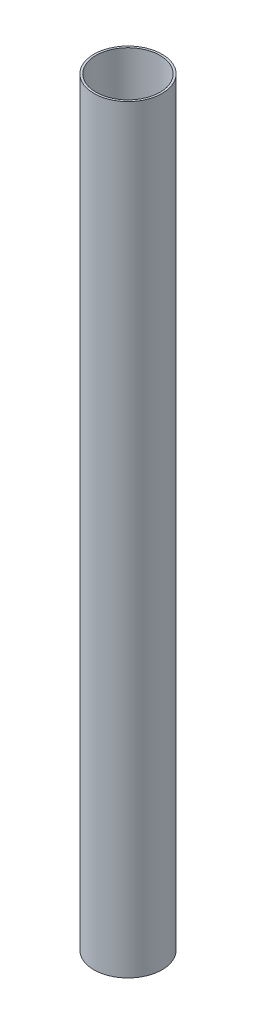
from build123d import *

# Parameters (mm, degrees)
SKETCH1_R           = 22.225
SKETCH1_R_2         = 20.8788
EXTRUDE_THIN1_DEPTH = 495.3


with BuildPart() as part:
    # Sketch1 → Extrude-Thin1 (new body)
    with BuildSketch(Plane(origin=(0, 0, 0), x_dir=(1, 0, 0), z_dir=(0, 1, 0))):
        Circle(SKETCH1_R)
        Circle(SKETCH1_R_2, mode=Mode.SUBTRACT)
    extrude(amount=EXTRUDE_THIN1_DEPTH)


solid = part.part
